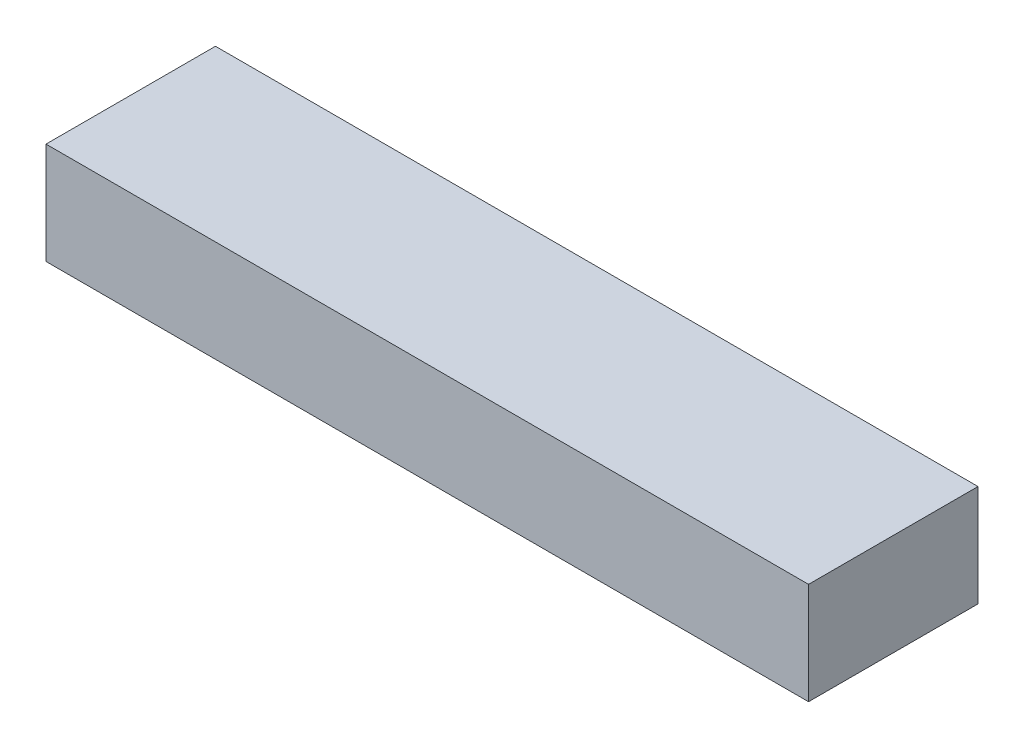
from build123d import *

# Parameters (mm, degrees)
SKETCH1_W           = 45
SKETCH1_H           = 10
BOSS_EXTRUDE1_DEPTH = 6


with BuildPart() as part:
    # Sketch1 → Boss-Extrude1 (new body)
    with BuildSketch(Plane(origin=(0, 0, 0), x_dir=(1, 0, 0), z_dir=(0, 1, 0))):
        with Locations((-2.156652361, -0.203862661)):
            Rectangle(SKETCH1_W, SKETCH1_H)
    extrude(amount=BOSS_EXTRUDE1_DEPTH)


solid = part.part
